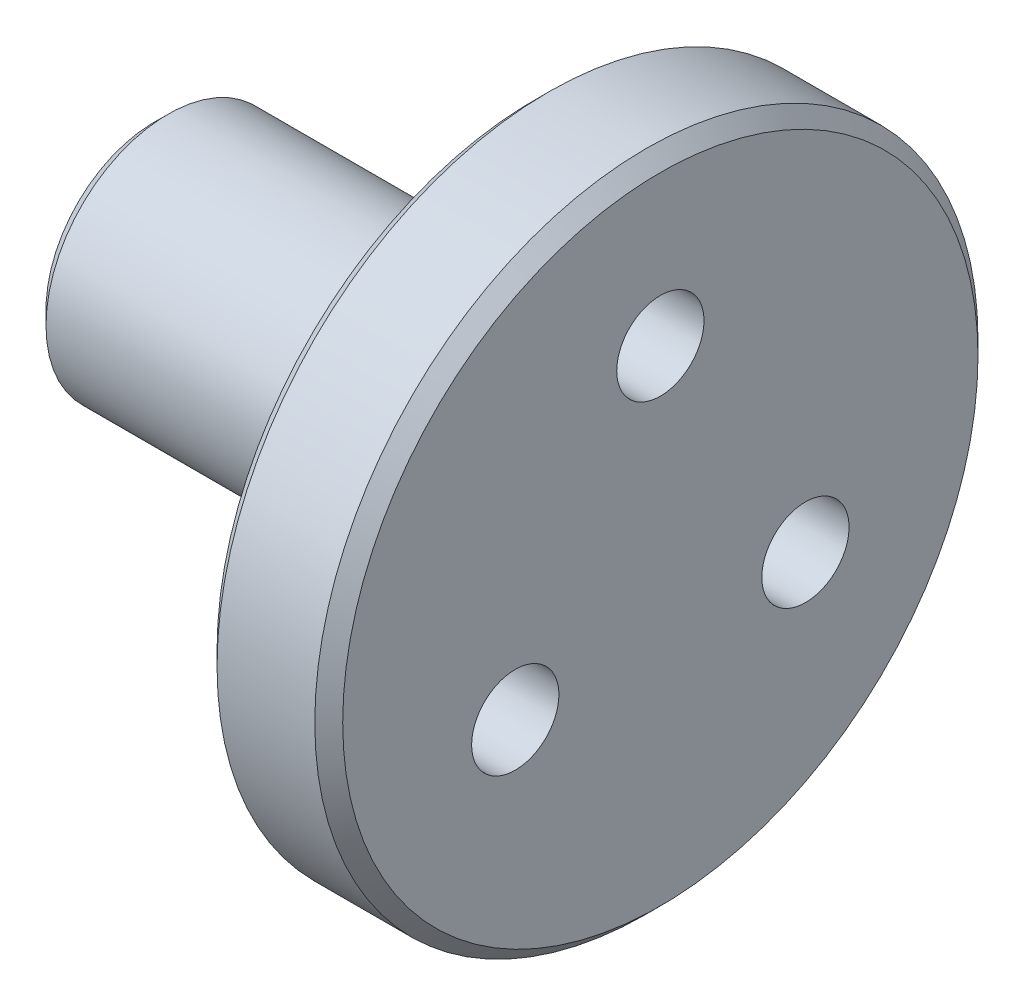
from build123d import *

# Parameters (mm, degrees)
SKETCH_3_R               = 1.25
CUT_EXTRUDE_1_DEPTH      = 18.300578025
CHAMFER_1_SIZE           = 0.4
PATTERN_CIRCULAR_1_COUNT = 3


with BuildPart() as part:
    # Эскиз2 → Повернуть1 (revolve)
    with BuildSketch(Plane.XY, mode=Mode.PRIVATE) as revolve_1_sk:
        Polygon((0, 0), (0, 9.5), (-3.6, 9.5), (-3.6, 3.5), (-14.5, 3.5), (-14.5, 0), align=None)
    revolve(revolve_1_sk.sketch.rotate(Axis((-14.5, 0, 0), (1, 0, 0)), 90), axis=Axis((-14.5, 0, 0), (1, 0, 0)))

    # Эскиз3 → Вырез-Вытянуть1 (cut, through all)
    with BuildSketch(Plane.ZY.offset(3.6)):
        with Locations((0, 4.8)):
            Circle(SKETCH_3_R)
    cut_extrude_1 = extrude(amount=-CUT_EXTRUDE_1_DEPTH, mode=Mode.SUBTRACT)

    # Фаска1
    chamfer_1_edges = [part.edges().sort_by_distance(p)[0] for p in [
        (-14.5, 0, -3.5),
        (-3.6, 0, -9.5),
        (0, 0, -9.5),
    ]]
    chamfer(chamfer_1_edges, length=CHAMFER_1_SIZE)

    # Круговой массив1: Вырез-Вытянуть1 ×3 about axis
    pattern_circular_1_axis = Axis((0, 0, 0), (1, 0, 0))
    for i in range(1, PATTERN_CIRCULAR_1_COUNT):
        add(cut_extrude_1.rotate(pattern_circular_1_axis, i * 360 / PATTERN_CIRCULAR_1_COUNT), mode=Mode.SUBTRACT)


solid = part.part
